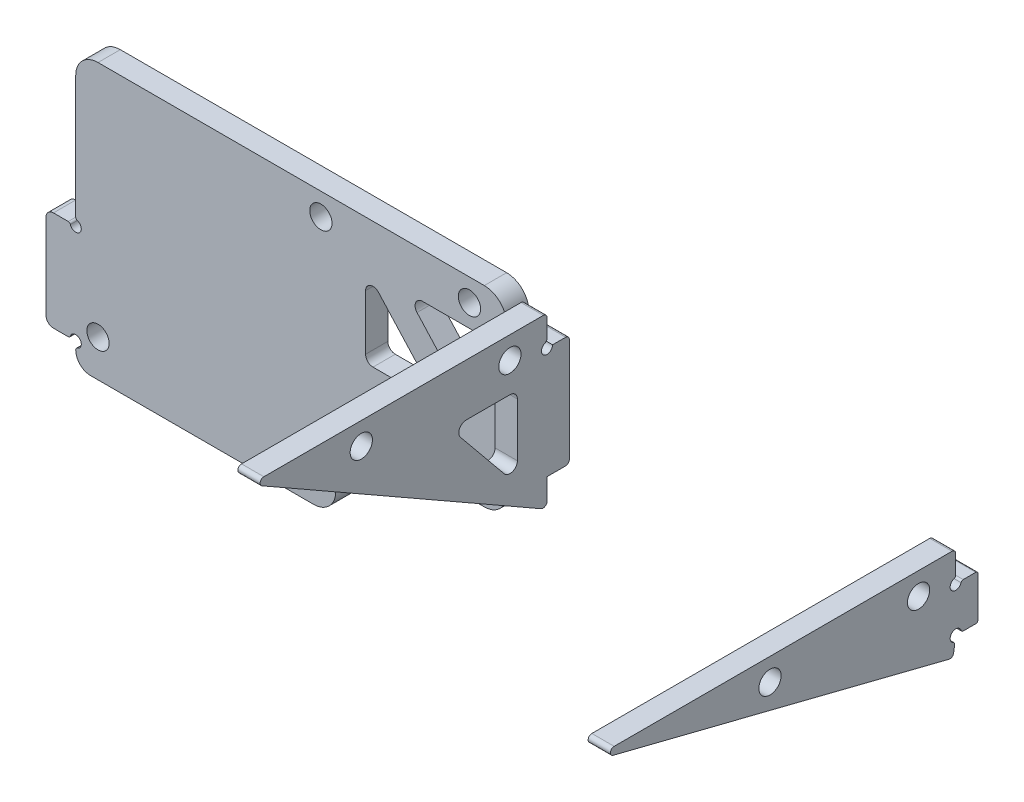
from build123d import *

# Parameters (mm, degrees)
EXTRUDE_2_DEPTH      = 3
CUT_EXTRUDE_2_DEPTH  = 10
SKETCH_6_R           = 1.5
CUT_EXTRUDE_4_DEPTH  = 10
FILLET_3_R           = 2
SKETCH_17_W          = 12.5
SKETCH_17_H          = 12
CUT_EXTRUDE_10_DEPTH = 10
SKETCH_18_W          = 4
SKETCH_18_H          = 13.44
EXTRUDE_3_DEPTH      = 3
SKETCH_19_R          = 0.75
CUT_EXTRUDE_11_DEPTH = 3
FILLET_6_R           = 1
SKETCH_21_R          = 0.75
SKETCH_21_W          = 3.03
SKETCH_21_H          = 6.05
SKETCH_21_H_2        = 15.05
CUT_EXTRUDE_12_DEPTH = 10
SKETCH_22_R          = 1.5
EXTRUDE_4_DEPTH      = 3
SKETCH_23_R          = 1.5
EXTRUDE_5_DEPTH      = 3
FILLET_8_R           = 0.5
CUT_EXTRUDE_14_DEPTH = 3
FILLET_10_R          = 1
SKETCH_28_R          = 0.75
CUT_EXTRUDE_17_DEPTH = 10
SKETCH_29_R          = 0.75
CUT_EXTRUDE_18_DEPTH = 10
FILLET_13_R          = 0.3
FILLET_17_R          = 0.3
SKETCH_30_R          = 1.5
CUT_EXTRUDE_19_DEPTH = 10
FILLET_21_R          = 0.3
FILLET_22_R          = 0.3
FILLET_26_R          = 0.5
CUT_EXTRUDE_22_DEPTH = 10
SKETCH_36_R          = 1.5
CUT_EXTRUDE_24_DEPTH = 10
SKETCH_37_W          = 12.5
SKETCH_37_H          = 12
EXTRUDE_6_DEPTH      = 3
FILLET_27_R          = 3
FILLET_28_R          = 1
SKETCH_39_W          = 77
SKETCH_39_H          = 25.770038503
CUT_EXTRUDE_25_DEPTH = 10
FILLET_29_R          = 3


with BuildPart() as part:
    # 草图1 → 凸台-拉伸2 (new body)
    with BuildSketch(Plane.XY):
        Polygon((0, 0), (0, 37), (35, 37), (135, 37), (135, 16.447466896), (135, 0), align=None)
    extrude(amount=EXTRUDE_2_DEPTH)

    # 草图4 → 切除-拉伸2 (cut)
    with BuildSketch(Plane.XY.offset(3)):
        Polygon((135, 12), (35.005000125, 11), (35.005000125, 0), (135, 0), align=None)
    extrude(amount=-CUT_EXTRUDE_2_DEPTH, mode=Mode.SUBTRACT)

    # 草图6 → 切除-拉伸4 (cut)
    with BuildSketch(Plane.XY.offset(3)):
        with Locations((3, 5)):
            Circle(SKETCH_6_R)
    extrude(amount=-CUT_EXTRUDE_4_DEPTH, mode=Mode.SUBTRACT)

    # 圆角3
    fillet_3_edges = [part.edges().sort_by_distance(p)[0] for p in [
        (0, 0, 1.5),
        (135, 12, 1.5),
    ]]
    fillet(fillet_3_edges, radius=FILLET_3_R)

    # 草图17 → 切除-拉伸10 (cut)
    with BuildSketch(Plane.XY.offset(3)):
        with Locations((6.25, 31)):
            Rectangle(SKETCH_17_W, SKETCH_17_H)
    extrude(amount=-CUT_EXTRUDE_10_DEPTH, mode=Mode.SUBTRACT)

    # 草图18 → 凸台-拉伸3 (add)
    with BuildSketch(Plane.XY.offset(3)):
        with Locations((-2, 9.75)):
            Rectangle(SKETCH_18_W, SKETCH_18_H)
    extrude(amount=-EXTRUDE_3_DEPTH)

    # 草图19 → 切除-拉伸11 (cut)
    with BuildSketch(Plane.XY.offset(3)):
        with Locations((0, 3.03)):
            Circle(SKETCH_19_R)
        with Locations((0, 16.47)):
            Circle(SKETCH_19_R)
    extrude(amount=-CUT_EXTRUDE_11_DEPTH, mode=Mode.SUBTRACT)

    # 圆角6
    fillet_6_edges = [part.edges().sort_by_distance(p)[0] for p in [
        (-4, 3.03, 1.5),
        (-4, 16.47, 1.5),
    ]]
    fillet(fillet_6_edges, radius=FILLET_6_R)

    # 草图21 → 切除-拉伸12 (cut)
    with BuildSketch(Plane.XY.offset(3)):
        with Locations((118.45, 27.95)):
            Circle(SKETCH_21_R)
        with Locations((118.45, 34)):
            Circle(SKETCH_21_R)
        with Locations((115.42, 34)):
            Circle(SKETCH_21_R)
        with Locations((115.42, 27.95)):
            Circle(SKETCH_21_R)
        with Locations((116.935, 30.975)):
            Rectangle(SKETCH_21_W, SKETCH_21_H)
        with BuildLine():
            Line((116.17, 34), (115.42, 34))
            Line((115.42, 34), (115.42, 33.25))
            ThreePointArc((115.42, 33.25), (115.950330086, 33.469669914), (116.17, 34))
        make_face()
        with BuildLine():
            Line((115.42, 33.25), (115.42, 34))
            Line((115.42, 34), (116.17, 34))
            ThreePointArc((116.17, 34), (114.889669914, 34.530330086), (115.42, 33.25))
        make_face()
        with BuildLine():
            ThreePointArc((119.2, 34), (118.45, 34.75), (117.7, 34))
            Line((117.7, 34), (118.45, 34))
            Line((118.45, 34), (118.45, 33.25))
            ThreePointArc((118.45, 33.25), (118.980330086, 33.469669914), (119.2, 34))
        make_face()
        with BuildLine():
            Line((118.45, 34), (117.7, 34))
            ThreePointArc((117.7, 34), (117.919669914, 33.469669914), (118.45, 33.25))
            Line((118.45, 33.25), (118.45, 34))
        make_face()
        with BuildLine():
            ThreePointArc((116.17, 27.95), (115.950330086, 28.480330086), (115.42, 28.7))
            Line((115.42, 28.7), (115.42, 27.95))
            Line((115.42, 27.95), (116.17, 27.95))
        make_face()
        with BuildLine():
            Line((115.42, 27.95), (115.42, 28.7))
            ThreePointArc((115.42, 28.7), (114.889669914, 27.419669914), (116.17, 27.95))
            Line((116.17, 27.95), (115.42, 27.95))
        make_face()
        with BuildLine():
            ThreePointArc((118.45, 28.7), (117.919669914, 28.480330086), (117.7, 27.95))
            Line((117.7, 27.95), (118.45, 27.95))
            Line((118.45, 27.95), (118.45, 28.7))
        make_face()
        with BuildLine():
            Line((118.45, 27.95), (117.7, 27.95))
            ThreePointArc((117.7, 27.95), (118.45, 27.2), (119.2, 27.95))
            ThreePointArc((119.2, 27.95), (118.980330086, 28.480330086), (118.45, 28.7))
            Line((118.45, 28.7), (118.45, 27.95))
        make_face()
        with Locations((63.45, 18.95)):
            Circle(SKETCH_21_R)
        with Locations((63.45, 34)):
            Circle(SKETCH_21_R)
        with Locations((60.42, 34)):
            Circle(SKETCH_21_R)
        with Locations((60.42, 18.95)):
            Circle(SKETCH_21_R)
        with Locations((61.935, 26.475)):
            Rectangle(SKETCH_21_W, SKETCH_21_H_2)
        with BuildLine():
            ThreePointArc((61.17, 18.95), (60.950330086, 19.480330086), (60.42, 19.7))
            Line((60.42, 19.7), (60.42, 18.95))
            Line((60.42, 18.95), (61.17, 18.95))
        make_face()
        with BuildLine():
            Line((60.42, 18.95), (60.42, 19.7))
            ThreePointArc((60.42, 19.7), (59.889669914, 18.419669914), (61.17, 18.95))
            Line((61.17, 18.95), (60.42, 18.95))
        make_face()
        with BuildLine():
            ThreePointArc((63.45, 19.7), (62.919669914, 19.480330086), (62.7, 18.95))
            Line((62.7, 18.95), (63.45, 18.95))
            Line((63.45, 18.95), (63.45, 19.7))
        make_face()
        with BuildLine():
            Line((63.45, 18.95), (62.7, 18.95))
            ThreePointArc((62.7, 18.95), (63.45, 18.2), (64.2, 18.95))
            ThreePointArc((64.2, 18.95), (63.980330086, 19.480330086), (63.45, 19.7))
            Line((63.45, 19.7), (63.45, 18.95))
        make_face()
        with BuildLine():
            Line((61.17, 34), (60.42, 34))
            Line((60.42, 34), (60.42, 33.25))
            ThreePointArc((60.42, 33.25), (60.950330086, 33.469669914), (61.17, 34))
        make_face()
        with BuildLine():
            Line((60.42, 33.25), (60.42, 34))
            Line((60.42, 34), (61.17, 34))
            ThreePointArc((61.17, 34), (59.889669914, 34.530330086), (60.42, 33.25))
        make_face()
        with BuildLine():
            ThreePointArc((64.2, 34), (63.45, 34.75), (62.7, 34))
            Line((62.7, 34), (63.45, 34))
            Line((63.45, 34), (63.45, 33.25))
            ThreePointArc((63.45, 33.25), (63.980330086, 33.469669914), (64.2, 34))
        make_face()
        with BuildLine():
            Line((63.45, 34), (62.7, 34))
            ThreePointArc((62.7, 34), (62.919669914, 33.469669914), (63.45, 33.25))
            Line((63.45, 33.25), (63.45, 34))
        make_face()
    extrude(amount=-CUT_EXTRUDE_12_DEPTH, mode=Mode.SUBTRACT)

    # 圆角13
    fillet_13_edges = [part.edges().sort_by_distance(p)[0] for p in [
        (-0.75, 16.47, 1.5),
        (-0.75, 3.03, 1.5),
        (0, 2.28, 1.5),
        (0, 17.22, 1.5),
    ]]
    fillet(fillet_13_edges, radius=FILLET_13_R)

    # 草图30 → 切除-拉伸19 (cut)
    with BuildSketch(Plane.XY.offset(3)):
        with Locations((110, 18.750337525)):
            Circle(SKETCH_30_R)
    extrude(amount=-CUT_EXTRUDE_19_DEPTH, mode=Mode.SUBTRACT)

    # 圆角21
    fillet_21_edges = [part.edges().sort_by_distance(p)[0] for p in [
        (63.45, 19.7, 1.5),
        (62.7, 18.95, 1.5),
        (61.17, 18.95, 1.5),
        (60.42, 19.7, 1.5),
        (60.42, 33.25, 1.5),
        (61.17, 34, 1.5),
        (62.7, 34, 1.5),
        (63.45, 33.25, 1.5),
    ]]
    fillet(fillet_21_edges, radius=FILLET_21_R)

    # 圆角22
    fillet_22_edges = [part.edges().sort_by_distance(p)[0] for p in [
        (118.45, 28.7, 1.5),
        (117.7, 27.95, 1.5),
        (116.17, 27.95, 1.5),
        (115.42, 28.7, 1.5),
        (115.42, 33.25, 1.5),
        (116.17, 34, 1.5),
        (117.7, 34, 1.5),
        (118.45, 33.25, 1.5),
    ]]
    fillet(fillet_22_edges, radius=FILLET_22_R)

    # 草图35 → 切除-拉伸22 (cut)
    with BuildSketch(Plane.XY.offset(3)):
        Polygon((39.014156819, 31), (39.014156819, 20), (49.014156819, 20), align=None)
        Polygon((44.42, 31), (54.42, 31), (54.42, 20), align=None)
    extrude(amount=-CUT_EXTRUDE_22_DEPTH, mode=Mode.SUBTRACT)

    # 草图36 → 切除-拉伸24 (cut)
    with BuildSketch(Plane.XY.offset(3)):
        with Locations((100, 34)):
            Circle(SKETCH_36_R)
        with Locations((80, 34)):
            Circle(SKETCH_36_R)
        with Locations((53, 34)):
            Circle(SKETCH_36_R)
        with Locations((33, 34)):
            Circle(SKETCH_36_R)
    extrude(amount=-CUT_EXTRUDE_24_DEPTH, mode=Mode.SUBTRACT)

    # 草图37 → 凸台-拉伸6 (add)
    with BuildSketch(Plane.XY.offset(3)):
        with Locations((6.25, 31)):
            Rectangle(SKETCH_37_W, SKETCH_37_H)
    extrude(amount=-EXTRUDE_6_DEPTH)

    # 圆角27
    fillet_27_edges = [part.edges().sort_by_distance(p)[0] for p in [
        (135, 37, 1.5),
        (35.005000125, 0, 1.5),
        (35.005000125, 11, 1.5),
        (0, 37, 1.5),
    ]]
    fillet(fillet_27_edges, radius=FILLET_27_R)

    # 圆角28
    fillet_28_edges = [part.edges().sort_by_distance(p)[0] for p in [
        (49.014156819, 20, 1.5),
        (39.014156819, 20, 1.5),
        (39.014156819, 31, 1.5),
        (54.42, 20, 1.5),
        (44.42, 31, 1.5),
        (54.42, 31, 1.5),
    ]]
    fillet(fillet_28_edges, radius=FILLET_28_R)

    # 草图39 → 切除-拉伸25 (cut)
    with BuildSketch(Plane.XY.offset(3)):
        with Locations((96.5, 24.114980749)):
            Rectangle(SKETCH_39_W, SKETCH_39_H)
    extrude(amount=-CUT_EXTRUDE_25_DEPTH, mode=Mode.SUBTRACT)

    # 圆角29
    fillet_29_edges = [part.edges().sort_by_distance(p)[0] for p in [
        (58, 11.229961497, 1.5),
        (58, 37, 1.5),
    ]]
    fillet(fillet_29_edges, radius=FILLET_29_R)


with BuildPart() as body_2:
    # 草图22 → 凸台-拉伸4 (new body)
    with BuildSketch(Plane.ZY.offset(-63.45)):
        Polygon((0, 33.95), (0, 18.95), (3, 18.95), (3, 15.15), (43.01, 38), (3.01, 38), (3.01, 33.95), align=None)
        with Locations(Location((8.01, 35, 0), (0, 0, 270))):
            Circle(SKETCH_22_R, mode=Mode.SUBTRACT)
        with Locations(Location((28.01, 35, 0), (0, 0, 270))):
            Circle(SKETCH_22_R, mode=Mode.SUBTRACT)
    extrude(amount=EXTRUDE_4_DEPTH)

    # 草图25 → 切除-拉伸14 (cut)
    with BuildSketch(Plane.ZY.offset(-60.45)):
        Polygon((7, 31), (7, 20), (16, 31), align=None)
    extrude(amount=-CUT_EXTRUDE_14_DEPTH, mode=Mode.SUBTRACT)

    # 圆角10
    fillet_10_edges = [body_2.edges().sort_by_distance(p)[0] for p in [
        (61.95, 31, 7),
        (61.95, 31, 16),
        (61.95, 20, 7),
    ]]
    fillet(fillet_10_edges, radius=FILLET_10_R)

    # 草图28 → 切除-拉伸17 (cut)
    with BuildSketch(Plane.ZY.offset(-60.45)):
        with Locations((3.01, 33.95)):
            Circle(SKETCH_28_R)
        with Locations((3, 14.920002627)):
            Circle(SKETCH_28_R)
    extrude(amount=-CUT_EXTRUDE_17_DEPTH, mode=Mode.SUBTRACT)

    # 圆角26
    fillet_26_edges = [body_2.edges().sort_by_distance(p)[0] for p in [
        (61.95, 38, 3.01),
        (61.95, 38, 43.01),
        (61.95, 18.95, 0),
        (61.95, 33.95, 0),
        (61.95, 34.7, 3.01),
        (61.95, 15.451949284, 3.528708572),
        (61.95, 15.670002627, 3),
    ]]
    fillet(fillet_26_edges, radius=FILLET_26_R)


with BuildPart() as body_3:
    # 草图23 → 凸台-拉伸5 (new body)
    with BuildSketch(Plane.ZY.offset(-118.45)):
        Polygon((0, 33.95), (0, 27.95), (3, 27.95), (3.359793817, 25.476025786), (53, 38), (3, 38), (3, 33.95), align=None)
        with Locations((8, 35)):
            Circle(SKETCH_23_R, mode=Mode.SUBTRACT)
        with Locations((28, 35)):
            Circle(SKETCH_23_R, mode=Mode.SUBTRACT)
    extrude(amount=EXTRUDE_5_DEPTH)

    # 圆角8
    fillet_8_edges = [body_3.edges().sort_by_distance(p)[0] for p in [
        (116.95, 38, 3),
        (116.95, 38, 53),
        (116.95, 25.476025786, 3.359793817),
    ]]
    fillet(fillet_8_edges, radius=FILLET_8_R)

    # 草图29 → 切除-拉伸18 (cut)
    with BuildSketch(Plane(origin=(118.45, 0, 0), x_dir=(0, 0, -1), z_dir=(1, 0, 0))):
        with Locations((-3, 33.95)):
            Circle(SKETCH_29_R)
        with Locations((-3, 27.95)):
            Circle(SKETCH_29_R)
    extrude(amount=-CUT_EXTRUDE_18_DEPTH, mode=Mode.SUBTRACT)

    # 圆角17
    fillet_17_edges = [body_3.edges().sort_by_distance(p)[0] for p in [
        (116.95, 27.95, 0),
        (116.95, 33.95, 0),
        (116.95, 34.7, 3),
        (116.95, 27.207807736, 3.107938145),
        (116.95, 33.95, 2.25),
        (116.95, 27.95, 2.25),
    ]]
    fillet(fillet_17_edges, radius=FILLET_17_R)


solid = Compound([part.part, body_2.part, body_3.part])
